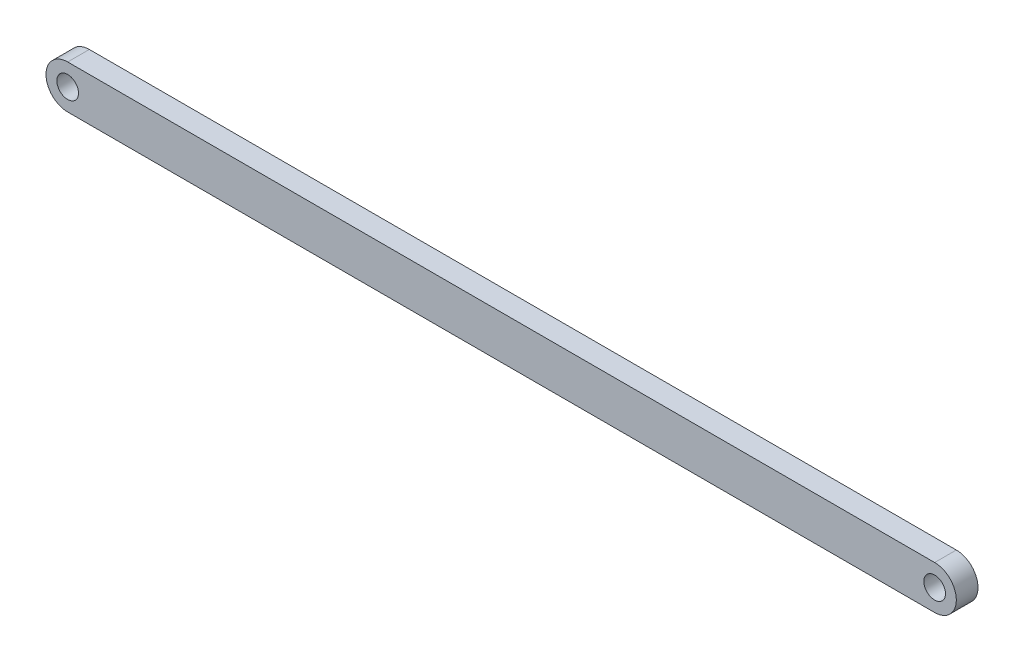
from build123d import *

# Parameters (mm, degrees)
SKETCH_1_R      = 2.5
EXTRUDE_2_DEPTH = 5


with BuildPart() as part:
    # 草图1 → 凸台-拉伸2 (new body)
    with BuildSketch(Plane.XY):
        with BuildLine():
            Line((0, 5), (200, 5))
            ThreePointArc((200, 5), (205, 0), (200, -5))
            Line((200, -5), (0, -5))
            ThreePointArc((0, -5), (-5, 0), (0, 5))
        make_face()
        Circle(SKETCH_1_R, mode=Mode.SUBTRACT)
        with Locations((200, 0)):
            Circle(SKETCH_1_R, mode=Mode.SUBTRACT)
    extrude(amount=EXTRUDE_2_DEPTH)


solid = part.part
